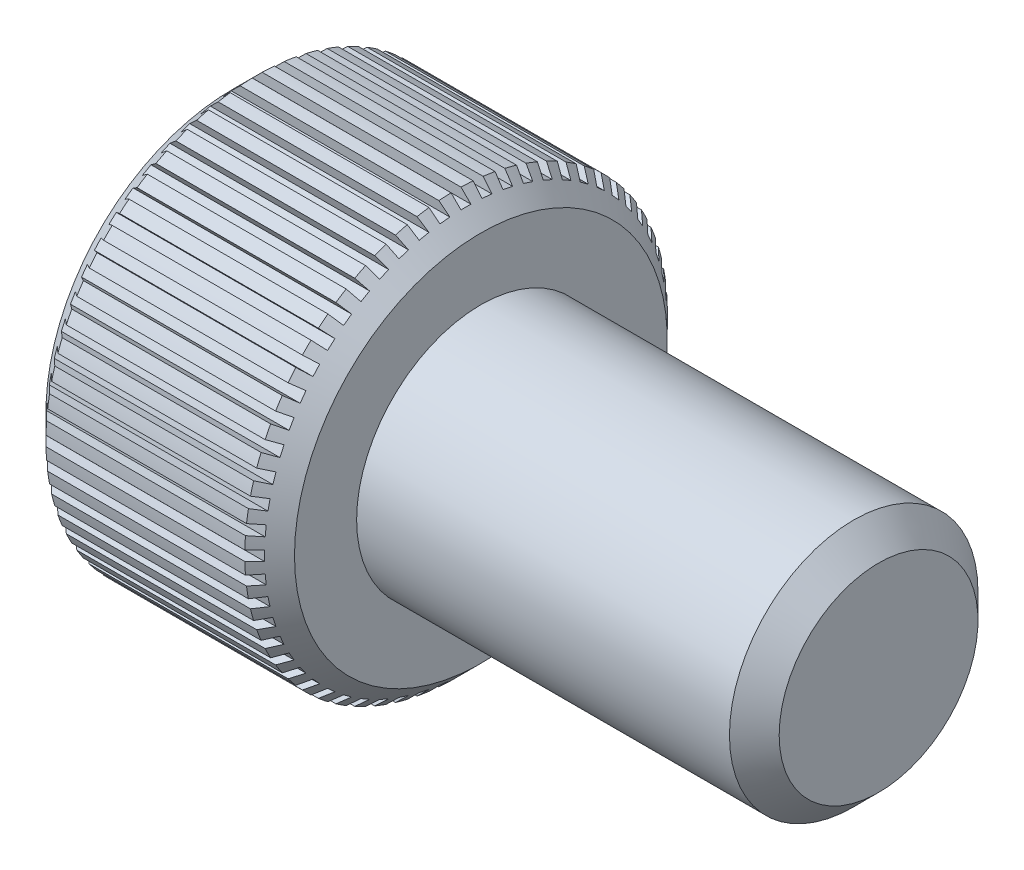
from build123d import *

# Parameters (mm, degrees)
CHAMFER1_SIZE      = 0.5
SKETCH2_W          = 0.2
SKETCH2_H          = 0.2
CUT_EXTRUDE1_DEPTH = 15.322185587
CIRPATTERN1_COUNT  = 60
CUT_EXTRUDE2_DEPTH = 2.5


with BuildPart() as part:
    # Sketch1 → Revolve1 (revolve)
    with BuildSketch(Plane.XY, mode=Mode.PRIVATE) as revolve1_sk:
        Polygon((13, 0), (13, 2.5), (5, 2.5), (5, 4.25), (0, 4.25), (0, 0), align=None)
    revolve(revolve1_sk.sketch.rotate(Axis((0, 0, 0), (1, 0, 0)), 90), axis=Axis((0, 0, 0), (1, 0, 0)))

    # Chamfer1
    chamfer1_edges = [part.edges().sort_by_distance(p)[0] for p in [
        (0, 0, -4.25),
        (5, 0, -4.25),
        (13, 0, -2.5),
    ]]
    chamfer(chamfer1_edges, length=CHAMFER1_SIZE)

    # Sketch2 → Cut-Extrude1 (cut, through all)
    with BuildSketch(Plane.ZY):
        with Locations((-4.15, 0)):
            Rectangle(SKETCH2_W, SKETCH2_H)
    cut_extrude1 = extrude(amount=-CUT_EXTRUDE1_DEPTH, mode=Mode.SUBTRACT)

    # CirPattern1: Cut-Extrude1 ×60 about axis
    cirpattern1_axis = Axis((0, 0, 0), (1, 0, 0))
    for i in range(1, CIRPATTERN1_COUNT):
        add(cut_extrude1.rotate(cirpattern1_axis, i * 360 / CIRPATTERN1_COUNT), mode=Mode.SUBTRACT)

    # Sketch3 → Cut-Extrude2 (cut)
    with BuildSketch(Plane.ZY):
        Polygon((-1.732050808, 0), (-0.866025404, -1.5), (0.866025404, -1.5), (1.732050808, 0), (0.866025404, 1.5), (-0.866025404, 1.5), align=None)
    extrude(amount=-CUT_EXTRUDE2_DEPTH, mode=Mode.SUBTRACT)


solid = part.part
